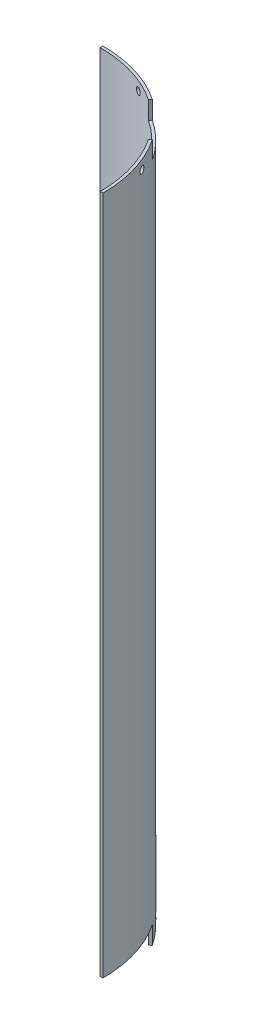
from build123d import *

# Parameters (mm, degrees)
BOSS_EXTRUDE1_DEPTH     = 504
CUT_EXTRUDE4_REACH      = 514.328
CUT_EXTRUDE4_END_RADIUS = 90
SKETCH6_R               = 2.5
CUT_EXTRUDE2_REACH      = 516.263
CUT_EXTRUDE2_END_RADIUS = 90
SKETCH3_R               = 2.5
CUT_EXTRUDE3_REACH      = 516.263
CUT_EXTRUDE3_END_RADIUS = 90
SKETCH5_R               = 2.5
LPATTERN2_COUNT         = 2
LPATTERN2_PITCH         = 491
CUT_EXTRUDE5_DEPTH      = 13
CUT_EXTRUDE6_START      = -13
CUT_EXTRUDE6_DEPTH      = 13
BODY_MOVE_COPY1_ANGLE   = 180


with BuildPart() as part:
    # Sketch1 → Boss-Extrude1 (new body)
    with BuildSketch(Plane(origin=(0, 0, 0), x_dir=(1, 0, 0), z_dir=(0, 1, 0))):
        with BuildLine():
            Line((0, 92), (0, 90))
            ThreePointArc((0, 90), (63.639610307, 63.639610307), (90, 0))
            Line((90, 0), (92, 0))
            ThreePointArc((92, 0), (65.053823869, 65.053823869), (0, 92))
        make_face()
    extrude(amount=BOSS_EXTRUDE1_DEPTH)

    # Cut-Extrude4: up to this cylinder (the profile starts outside it)
    cut_extrude4_end = Plane(origin=(0, 6.5, 0), z_dir=(0, -1, 0)) * Cylinder(CUT_EXTRUDE4_END_RADIUS, 1209.656, mode=Mode.PRIVATE)
    # Sketch6 → Cut-Extrude4 (cut, up to the surface)
    with BuildSketch(Plane(origin=(65.053823869, 0, -65.053823869), x_dir=(-0.7071067811865486, 0, -0.7071067811865465), z_dir=(0.7071067811865465, 0, -0.7071067811865486)), mode=Mode.PRIVATE) as cut_extrude4_sk1:
        with Locations((0, 6.5)):
            Circle(SKETCH6_R)
    cut_extrude4_tool1 = extrude(cut_extrude4_sk1.sketch, amount=-CUT_EXTRUDE4_REACH, mode=Mode.PRIVATE) - cut_extrude4_end
    cut_extrude4 = cut_extrude4_tool1.solids().sort_by_distance((65.053824, 6.5, -65.053824))[0]
    add(cut_extrude4, mode=Mode.SUBTRACT)

    # Cut-Extrude2: up to this cylinder (the profile starts outside it)
    cut_extrude2_end = Plane(origin=(0, 6.5, 0), z_dir=(0, -1, 0)) * Cylinder(CUT_EXTRUDE2_END_RADIUS, 1213.526, mode=Mode.PRIVATE)
    # Sketch3 → Cut-Extrude2 (cut, up to the surface)
    with BuildSketch(Plane(origin=(84.996916991, 0, -35.206875778), x_dir=(-0.38268343236509045, 0, -0.9238795325112865), z_dir=(0.9238795325112865, 0, -0.38268343236509045)), mode=Mode.PRIVATE) as cut_extrude2_sk1:
        with Locations((0, 6.5)):
            Circle(SKETCH3_R)
    cut_extrude2_tool1 = extrude(cut_extrude2_sk1.sketch, amount=-CUT_EXTRUDE2_REACH, mode=Mode.PRIVATE) - cut_extrude2_end
    cut_extrude2 = cut_extrude2_tool1.solids().sort_by_distance((84.996917, 6.5, -35.206876))[0]
    add(cut_extrude2, mode=Mode.SUBTRACT)

    # Cut-Extrude3: up to this cylinder (the profile starts outside it)
    cut_extrude3_end = Plane(origin=(0, 6.5, 0), z_dir=(0, -1, 0)) * Cylinder(CUT_EXTRUDE3_END_RADIUS, 1213.526, mode=Mode.PRIVATE)
    # Sketch5 → Cut-Extrude3 (cut, up to the surface)
    with BuildSketch(Plane(origin=(35.206875778, 0, -84.996916991), x_dir=(-0.9238795325112878, 0, -0.3826834323650876), z_dir=(0.3826834323650876, 0, -0.9238795325112878)), mode=Mode.PRIVATE) as cut_extrude3_sk1:
        with Locations((0, 6.5)):
            Circle(SKETCH5_R)
    cut_extrude3_tool1 = extrude(cut_extrude3_sk1.sketch, amount=-CUT_EXTRUDE3_REACH, mode=Mode.PRIVATE) - cut_extrude3_end
    cut_extrude3 = cut_extrude3_tool1.solids().sort_by_distance((35.206876, 6.5, -84.996917))[0]
    add(cut_extrude3, mode=Mode.SUBTRACT)

    # LPattern2: Cut-Extrude4, Cut-Extrude2, Cut-Extrude3 ×2
    with Locations(*[(0, i * LPATTERN2_PITCH, 0) for i in range(1, LPATTERN2_COUNT)]):
        add(cut_extrude4, mode=Mode.SUBTRACT)
        add(cut_extrude2, mode=Mode.SUBTRACT)
        add(cut_extrude3, mode=Mode.SUBTRACT)

    # Sketch7 → Cut-Extrude5 (cut)
    with BuildSketch(Plane.XZ):
        with BuildLine():
            Line((76.447375943, -51.183969281), (74.784435976, -50.072828318))
            ThreePointArc((74.784435976, -50.072828318), (63.639610307, -63.639610307), (50.072828318, -74.784435976))
            Line((50.072828318, -74.784435976), (51.183969281, -76.447375943))
            ThreePointArc((51.183969281, -76.447375943), (65.053823869, -65.053823869), (76.447375943, -51.183969281))
        make_face()
    extrude(amount=-CUT_EXTRUDE5_DEPTH, mode=Mode.SUBTRACT)

    # Sketch9 → Cut-Extrude6 (cut)
    with BuildSketch(Plane(origin=(0, 504, 0), x_dir=(1, 0, 0), z_dir=(0, 1, 0)).offset(CUT_EXTRUDE6_START)):
        with BuildLine():
            ThreePointArc((0, 90), (26.125620953, 86.124630216), (50.001320972, 74.832265107))
            Line((50.001320972, 74.832265107), (51.112461438, 76.495204332))
            ThreePointArc((51.112461438, 76.495204332), (26.706190307, 88.038510887), (0, 92))
            Line((0, 92), (0, 90))
        make_face()
        with BuildLine():
            ThreePointArc((74.832265107, 50.001320972), (86.124630216, 26.125620953), (90, 0))
            Line((90, 0), (92, 0))
            ThreePointArc((92, 0), (88.038510887, 26.706190307), (76.495204332, 51.112461438))
            Line((76.495204332, 51.112461438), (74.832265107, 50.001320972))
        make_face()
    extrude(amount=CUT_EXTRUDE6_DEPTH, mode=Mode.SUBTRACT)


with BuildPart() as part_1:
    # Body-Move/Copy1: moved
    add(part.part.moved(Location((0, 0, 0))).rotate(Axis((0, 252, 0), (0.7071067811865488, -4.937700262164522e-15, -0.7071067811865462)), BODY_MOVE_COPY1_ANGLE))


solid = part_1.part
